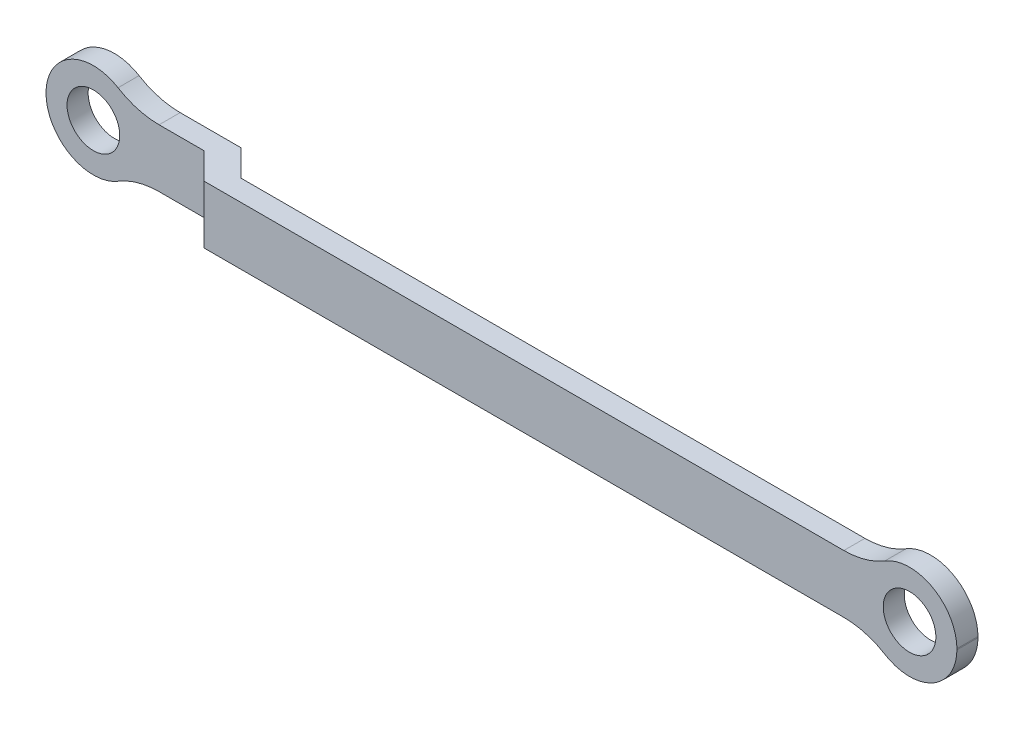
from build123d import *

# Parameters (mm, degrees)
SKETCH_2_R               = 5
SKETCH_2_R_2             = 1.999999992
EXTRUDE_1_DEPTH          = 9
CUT_EXTRUDE_1_DEPTH      = 170.859032113
CUT_EXTRUDE_1_DEPTH_BACK = 170.859032113
SKETCH_4_R               = 5
CUT_EXTRUDE_2_DEPTH      = 170.478188001


with BuildPart() as part:
    # 草图2 → 凸台-拉伸1 (new body)
    with BuildSketch(Plane.XY):
        with BuildLine():
            Line((147.519937563, 5.502226824), (12.479900949, 5.500188388))
            ThreePointArc((12.479900949, 5.500188388), (8.429429601, 6.057352235), (4.679877945, 7.687570645))
            ThreePointArc((4.679877945, 7.687570645), (-4.365546387, 7.87032431), (-8.999445953, 0.099862608))
            Line((-8.999445953, 0.099862608), (-8.999442934, -0.100134306))
            ThreePointArc((-8.999442934, -0.100134306), (-4.365308776, -7.870456104), (4.680110035, -7.687429353))
            ThreePointArc((4.680110035, -7.687429353), (8.429612472, -6.057097743), (12.480066997, -5.499811611))
            Line((12.480066997, -5.499811611), (147.520099033, -5.497773175))
            ThreePointArc((147.520099033, -5.497773175), (151.570570386, -6.054937034), (155.320122044, -7.68515546))
            ThreePointArc((155.320122044, -7.68515546), (164.365546377, -7.867909125), (168.999445942, -0.097447423))
            Line((168.999445942, -0.097447423), (168.999442923, 0.102549491))
            ThreePointArc((168.999442923, 0.102549491), (164.365308765, 7.87287129), (155.319889955, 7.689844539))
            ThreePointArc((155.319889955, 7.689844539), (151.570389715, 6.05951356), (147.519937563, 5.502226824))
        make_face()
        Circle(SKETCH_2_R, mode=Mode.SUBTRACT)
        with Locations((159.999999989, 0.002415185)):
            Circle(SKETCH_2_R_2, mode=Mode.SUBTRACT)
    extrude(amount=EXTRUDE_1_DEPTH)

    # 草图3 → 切除-拉伸1 (cut, two sides: drawn at the far end of the back side and taken through both)
    with BuildSketch(Plane(origin=(-8.3023e-05, 5.500000002, 0), x_dir=(0.9999999998860698, 1.509504600630928e-05, 0), z_dir=(-1.509504600630928e-05, 0.9999999998860698, 0)).offset(-CUT_EXTRUDE_1_DEPTH_BACK)):
        Polygon((21.000555556, -4), (26.000555556, -9), (-8.999444444, -9), (-8.999444444, -4), align=None)
        Polygon((29.000555556, -5), (24.000555556, 0), (168.999444452, 0), (168.999444452, -5), align=None)
    extrude(amount=CUT_EXTRUDE_1_DEPTH + CUT_EXTRUDE_1_DEPTH_BACK, mode=Mode.SUBTRACT)

    # 草图4 → 切除-拉伸2 (cut, through all)
    with BuildSketch(Plane.XY.offset(9)):
        with Locations((159.999999989, 0.002415185)):
            Circle(SKETCH_4_R)
    extrude(amount=-CUT_EXTRUDE_2_DEPTH, mode=Mode.SUBTRACT)


solid = part.part
